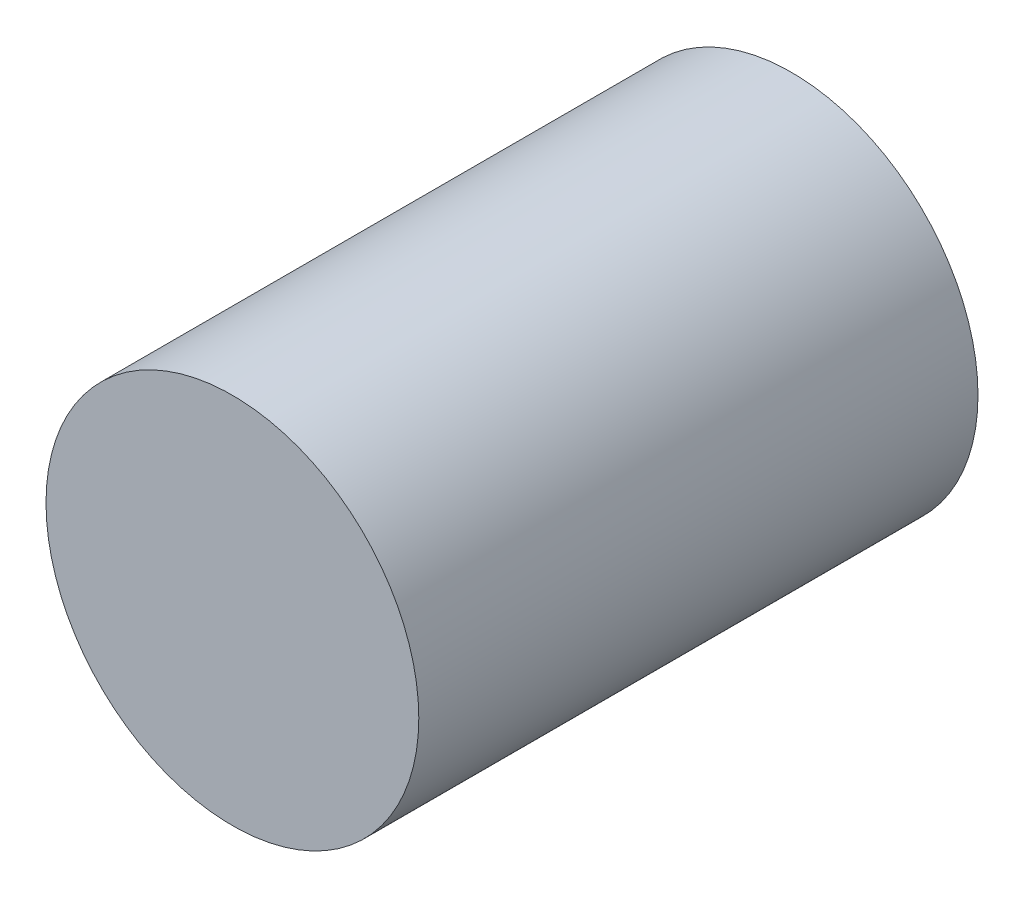
from build123d import *

# Parameters (mm, degrees)
SKETCH2_R           = 10
BOSS_EXTRUDE2_DEPTH = 30


with BuildPart() as part:
    # Sketch2 → Boss-Extrude2 (new body)
    with BuildSketch(Plane.XY):
        Circle(SKETCH2_R)
    extrude(amount=BOSS_EXTRUDE2_DEPTH)


solid = part.part
